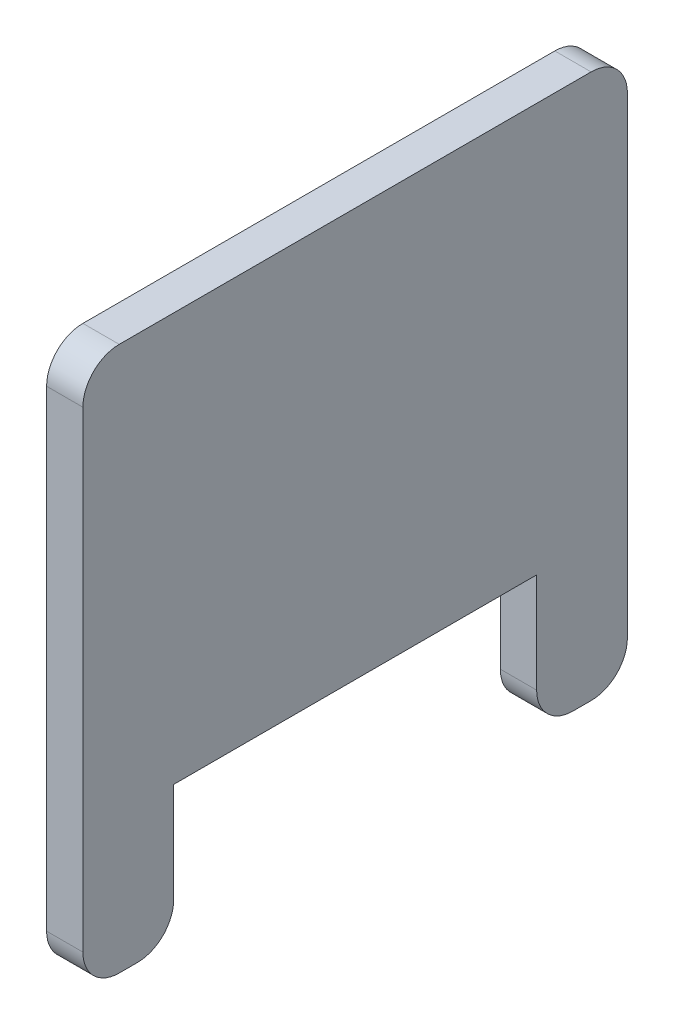
from build123d import *

# Parameters (mm, degrees)
SKETCH10_W          = 150
SKETCH10_H          = 150
BOSS_EXTRUDE3_DEPTH = 10
SKETCH12_W          = 100
SKETCH12_H          = 37.5
CUT_EXTRUDE2_DEPTH  = 10
FILLET7_R           = 10


with BuildPart() as part:
    # Sketch10 → Boss-Extrude3 (new body)
    with BuildSketch(Plane(origin=(0, 0, 0), x_dir=(0, 0, -1), z_dir=(1, 0, 0))):
        with Locations((75, 112.5)):
            Rectangle(SKETCH10_W, SKETCH10_H)
    extrude(amount=BOSS_EXTRUDE3_DEPTH)

    # Sketch12 → Cut-Extrude2 (cut)
    with BuildSketch(Plane.ZY):
        with Locations((-75, 56.25)):
            Rectangle(SKETCH12_W, SKETCH12_H)
    extrude(amount=-CUT_EXTRUDE2_DEPTH, mode=Mode.SUBTRACT)

    # Fillet7
    fillet7_edges = [part.edges().sort_by_distance(p)[0] for p in [
        (5, 37.5, -125),
        (5, 37.5, -25),
        (5, 187.5, 0),
        (5, 187.5, -150),
        (5, 37.5, -150),
        (5, 37.5, 0),
    ]]
    fillet(fillet7_edges, radius=FILLET7_R)


solid = part.part
